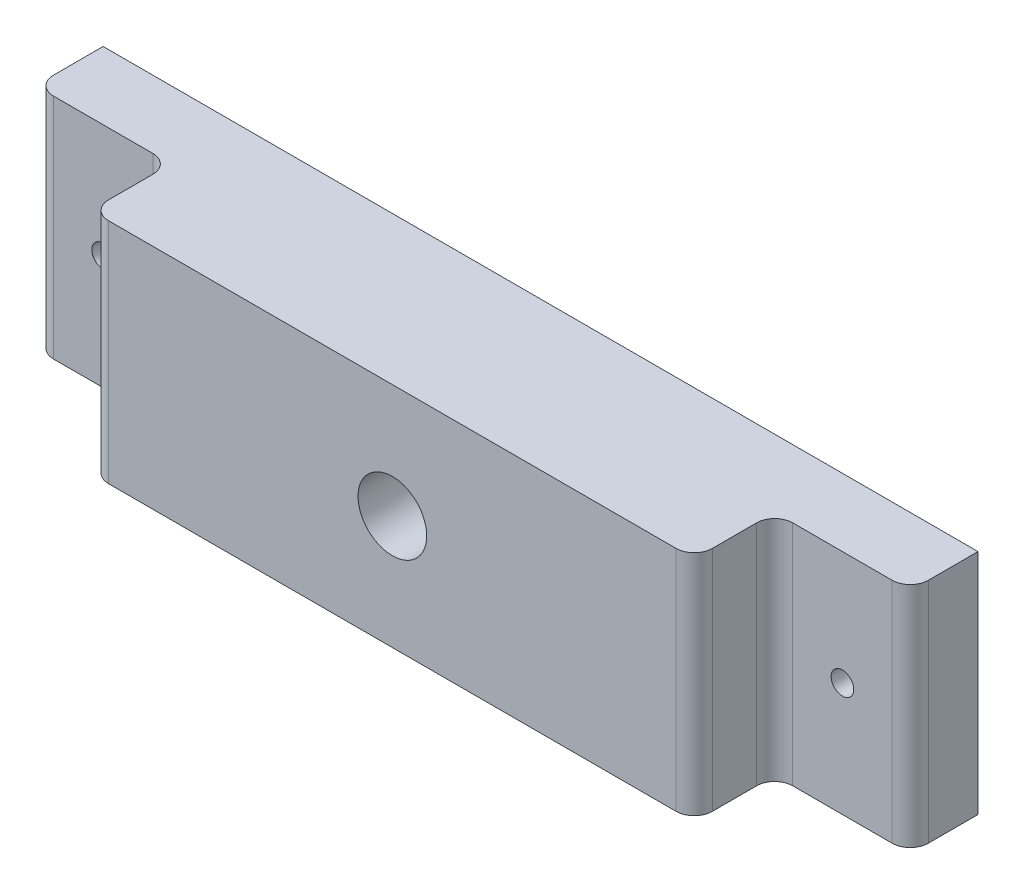
from build123d import *

# Parameters (mm, degrees)
BOSS_EXTRUDE1_DEPTH = 16.002
FILLET1_R           = 1.27
SKETCH2_R           = 2.413
CUT_EXTRUDE1_DEPTH  = 40.990161384
SKETCH3_R           = 0.79375
CUT_EXTRUDE2_DEPTH  = 40.021802416


with BuildPart() as part:
    # Sketch1 → Boss-Extrude1 (new body)
    with BuildSketch(Plane(origin=(0, 0, 0), x_dir=(1, 0, 0), z_dir=(0, 1, 0))):
        Polygon((4.404264151, -0.835084906), (4.404264151, 9.578915094), (-26.329735849, 9.578915094), (-26.329735849, 4.816415094), (-16.804735849, 4.816415094), (-16.804735849, -0.835084906), align=None)
        Polygon((35.138264151, 4.816415094), (35.138264151, 9.578915094), (4.404264151, 9.578915094), (4.404264151, -0.835084906), (25.613264151, -0.835084906), (25.613264151, 4.816415094), align=None)
    extrude(amount=BOSS_EXTRUDE1_DEPTH)

    # Fillet1
    fillet1_edges = [part.edges().sort_by_distance(p)[0] for p in [
        (-16.804735849, 8.001, 0.835084906),
        (-16.804735849, 8.001, -4.816415094),
        (-26.329735849, 8.001, -4.816415094),
        (35.138264151, 8.001, -4.816415094),
        (25.613264151, 8.001, -4.816415094),
        (25.613264151, 8.001, 0.835084906),
    ]]
    fillet(fillet1_edges, radius=FILLET1_R)

    # Sketch2 → Cut-Extrude1 (cut, through all)
    with BuildSketch(Plane.XY.offset(0.835084906)):
        with Locations((4.404264151, 8.001)):
            Circle(SKETCH2_R)
    extrude(amount=-CUT_EXTRUDE1_DEPTH, mode=Mode.SUBTRACT)

    # Sketch3 → Cut-Extrude2 (cut, through all)
    with BuildSketch(Plane.XY.offset(-4.816415094)):
        with Locations((-21.567235849, 8.001)):
            Circle(SKETCH3_R)
        with Locations((30.375764151, 8.001)):
            Circle(SKETCH3_R)
    extrude(amount=-CUT_EXTRUDE2_DEPTH, mode=Mode.SUBTRACT)


solid = part.part
